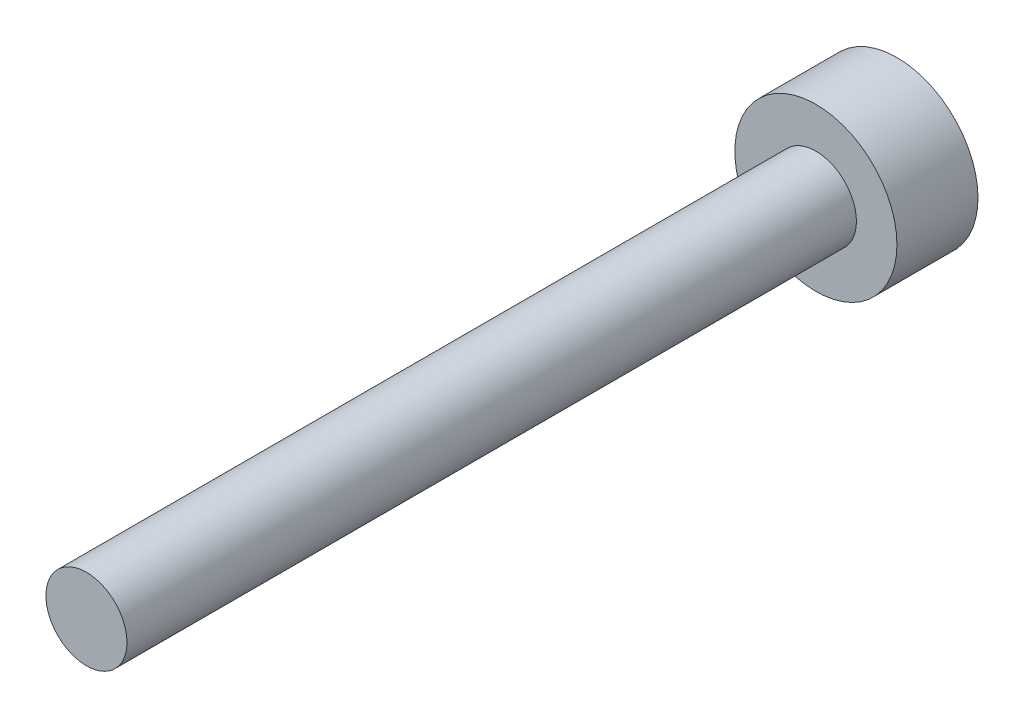
from build123d import *

# Parameters (mm, degrees)
CROQUIS1_R              = 1.5
SALIENTE_EXTRUIR1_DEPTH = 30
CROQUIS2_R              = 3
SALIENTE_EXTRUIR2_DEPTH = 3


with BuildPart() as part:
    # Croquis1 → Saliente-Extruir1 (new body)
    with BuildSketch(Plane.XY):
        with Locations((13.181557154, 0)):
            Circle(CROQUIS1_R)
    extrude(amount=SALIENTE_EXTRUIR1_DEPTH)

    # Croquis2 → Saliente-Extruir2 (add)
    with BuildSketch(Plane.XY):
        with Locations((13.181557154, 0)):
            Circle(CROQUIS2_R)
    extrude(amount=SALIENTE_EXTRUIR2_DEPTH)


solid = part.part
